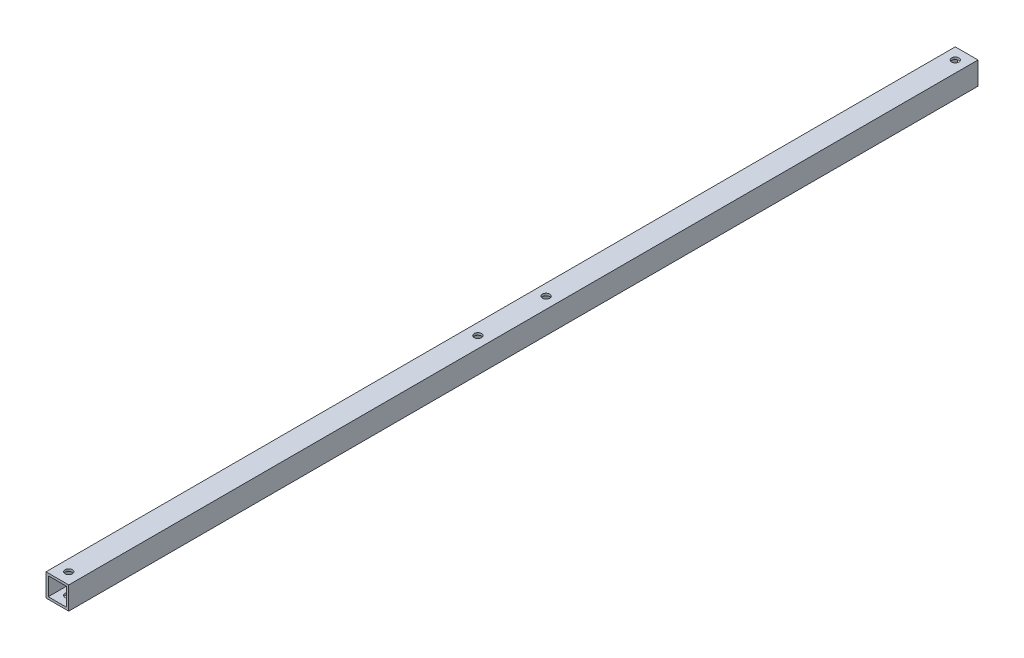
from build123d import *

# Parameters (mm, degrees)
SKETCH_1_W          = 10
SKETCH_1_H          = 10
SKETCH_1_W_2        = 8
SKETCH_1_H_2        = 8
EXTRUDE_1_DEPTH     = 399.7114317
SKETCH_2_R          = 1.6
CUT_EXTRUDE_1_DEPTH = 408.37168574


with BuildPart() as part:
    # ｽｹｯﾁ1 → ﾎﾞｽ - 押し出し1 (new body)
    with BuildSketch(Plane.XY):
        Rectangle(SKETCH_1_W, SKETCH_1_H)
        Rectangle(SKETCH_1_W_2, SKETCH_1_H_2, mode=Mode.SUBTRACT)
    extrude(amount=EXTRUDE_1_DEPTH)

    # ｽｹｯﾁ2 → ｶｯﾄ - 押し出し1 (cut)
    with BuildSketch(Plane(origin=(0, 5, 0), x_dir=(1, 0, 0), z_dir=(0, 1, 0))):
        with Locations(Location((0, -5, 0), (0, 0, 270))):
            Circle(SKETCH_2_R)
        with Locations(Location((0, -394.7114317, 0), (0, 0, 270))):
            Circle(SKETCH_2_R)
        with Locations(Location((0, -184.85571585, 0), (0, 0, 270))):
            Circle(SKETCH_2_R)
        with Locations(Location((0, -214.85571585, 0), (0, 0, 270))):
            Circle(SKETCH_2_R)
    extrude(amount=-CUT_EXTRUDE_1_DEPTH, mode=Mode.SUBTRACT)


solid = part.part
